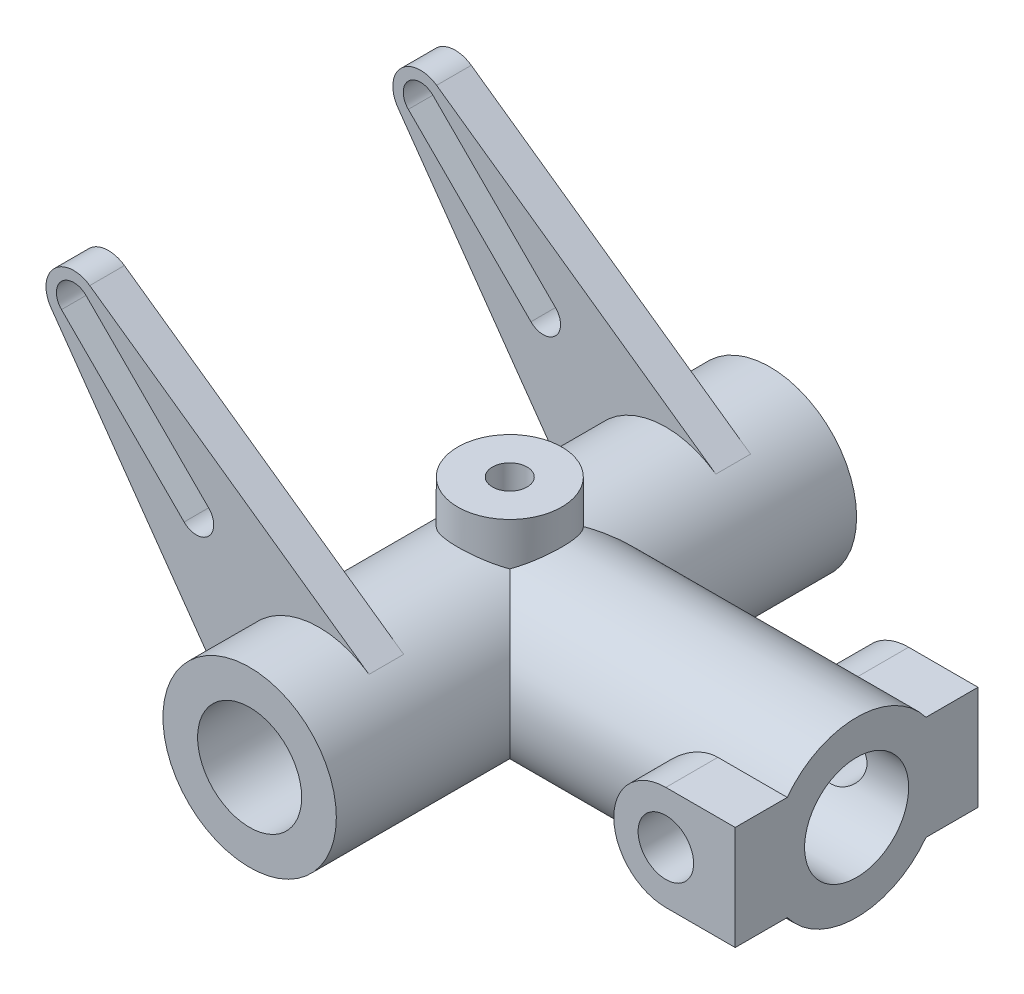
from build123d import *
from build123d.topology import SkipClean

# Parameters (mm, degrees)
CROQUIS1_R                   = 25
CROQUIS1_R_2                 = 15
SALIENTE_EXTRUIR1_DEPTH      = 150
SALIENTE_EXTRUIR2_DEPTH      = 10
SALIENTE_EXTRUIR3_START      = 10
SALIENTE_EXTRUIR3_DEPTH      = 10
SALIENTE_EXTRUIR4_REACH      = 248.237
SALIENTE_EXTRUIR4_END_RADIUS = 25
CROQUIS4_R                   = 25
CROQUIS4_R_2                 = 15
CROQUIS5_R                   = 8
SALIENTE_EXTRUIR5_DEPTH      = 35
CROQUIS6_R                   = 8
CORTAR_EXTRUIR1_DEPTH        = 169.212279189
CORTAR_EXTRUIR2_REACH        = 248.237
CROQUIS7_R                   = 15
SALIENTE_EXTRUIR6_REACH      = 192
SALIENTE_EXTRUIR6_END_RADIUS = 25
CROQUIS8_R                   = 15
CROQUIS8_R_2                 = 5
CORTAR_EXTRUIR3_REACH        = 192
CROQUIS9_R                   = 5


with BuildPart() as part:
    # Croquis1 → Saliente-Extruir1 (new body)
    with BuildSketch(Plane.XY):
        Circle(CROQUIS1_R)
        Circle(CROQUIS1_R_2, mode=Mode.SUBTRACT)
    extrude(amount=SALIENTE_EXTRUIR1_DEPTH)

    # Croquis2 → Saliente-Extruir2 (add)
    with BuildSketch(Plane.XY.offset(120)):
        with BuildLine():
            Line((-77.246856773, 66.097829909), (-20.425558294, -14.415150654))
            ThreePointArc((-20.425558294, -14.415150654), (-17.67766953, 17.67766953), (14.415150654, 20.425558294))
            Line((14.415150654, 20.425558294), (-66.097829909, 77.246856773))
            ThreePointArc((-66.097829909, 77.246856773), (-76.367532368, 76.367532368), (-77.246856773, 66.097829909))
        make_face()
        with BuildLine():
            Line((-67.175144213, 74.246212025), (-31.819805153, 38.890872965))
            ThreePointArc((-31.819805153, 38.890872965), (-31.819805153, 31.819805153), (-38.890872965, 31.819805153))
            Line((-38.890872965, 31.819805153), (-74.246212025, 67.175144213))
            ThreePointArc((-74.246212025, 67.175144213), (-74.246212025, 74.246212025), (-67.175144213, 74.246212025))
        make_face(mode=Mode.SUBTRACT)
    extrude(amount=SALIENTE_EXTRUIR2_DEPTH)

    # Croquis3 → Saliente-Extruir3 (add)
    with BuildSketch(Plane(origin=(0, 0, 30), x_dir=(-1, 0, 0), z_dir=(0, 0, -1)).offset(SALIENTE_EXTRUIR3_START)):
        with BuildLine():
            Line((77.246856773, 66.097829909), (20.425558294, -14.415150654))
            ThreePointArc((20.425558294, -14.415150654), (17.67766953, 17.67766953), (-14.415150654, 20.425558294))
            Line((-14.415150654, 20.425558294), (66.097829909, 77.246856773))
            ThreePointArc((66.097829909, 77.246856773), (76.367532368, 76.367532368), (77.246856773, 66.097829909))
        make_face()
        with BuildLine():
            Line((74.246212025, 67.175144213), (38.890872965, 31.819805153))
            ThreePointArc((38.890872965, 31.819805153), (31.819805153, 31.819805153), (31.819805153, 38.890872965))
            Line((31.819805153, 38.890872965), (67.175144213, 74.246212025))
            ThreePointArc((67.175144213, 74.246212025), (74.246212025, 74.246212025), (74.246212025, 67.175144213))
        make_face(mode=Mode.SUBTRACT)
    extrude(amount=-SALIENTE_EXTRUIR3_DEPTH)

    # Saliente-Extruir4: up to this cylinder (the profile starts outside it)
    saliente_extruir4_end = Plane(origin=(0, 0, 99.292893), z_dir=(0, 0, -1)) * Cylinder(SALIENTE_EXTRUIR4_END_RADIUS, 547.474, mode=Mode.PRIVATE)
    # Croquis4 → Saliente-Extruir4 (add, up to the surface)
    with BuildSketch(Plane(origin=(100, 0, 0), x_dir=(0, 0, -1), z_dir=(1, 0, 0)), mode=Mode.PRIVATE) as saliente_extruir4_sk1:
        with Locations((-75, 0)):
            Circle(CROQUIS4_R)
        with Locations((-75, 0)):
            Circle(CROQUIS4_R_2, mode=Mode.SUBTRACT)
    saliente_extruir4_tool1 = extrude(saliente_extruir4_sk1.sketch, amount=-SALIENTE_EXTRUIR4_REACH, mode=Mode.PRIVATE) - saliente_extruir4_end
    add(saliente_extruir4_tool1.solids().sort_by_distance((100, 0, 99.292893))[0])

    # Croquis5 → Saliente-Extruir5 (add, symmetric)
    with BuildSketch(Plane.XY.offset(75)):
        with BuildLine():
            Line((100, -15), (100, 0))
            Line((100, 0), (100, 15))
            Line((100, 15), (80, 15))
            ThreePointArc((80, 15), (65, 0), (80, -15))
            Line((80, -15), (100, -15))
        make_face()
        with Locations(Location((80, 0, 0), (0, 0, 180))):
            Circle(CROQUIS5_R, mode=Mode.SUBTRACT)
    extrude(amount=SALIENTE_EXTRUIR5_DEPTH, both=True)

    # Croquis6 → Cortar-Extruir1 (cut, through all)
    with BuildSketch(Plane.XY.offset(110)):
        with Locations((80, 0)):
            Circle(CROQUIS6_R)
    extrude(amount=-CORTAR_EXTRUIR1_DEPTH, mode=Mode.SUBTRACT)

    # Croquis7 → Cortar-Extruir2 (cut, up to next)
    with BuildSketch(Plane(origin=(100, 0, 0), x_dir=(0, 0, -1), z_dir=(1, 0, 0)), mode=Mode.PRIVATE) as cortar_extruir2_sk1:
        with Locations((-75, 0)):
            Circle(CROQUIS7_R)
    cortar_extruir2_tool1 = extrude(cortar_extruir2_sk1.sketch, amount=-CORTAR_EXTRUIR2_REACH, mode=Mode.PRIVATE) & part.part
    add(cortar_extruir2_tool1.solids().sort_by_distance((100, 0, 75))[0], mode=Mode.SUBTRACT)
    add(cortar_extruir2_tool1.solids().sort_by_distance((100, 0, 75))[1], mode=Mode.SUBTRACT)

    # Saliente-Extruir6: up to this cylinder (the profile starts outside it)
    with SkipClean():  # the faces are left unmerged after this step: merging them gives an invalid solid
        saliente_extruir6_end = Plane(origin=(0, 0, 60.424264), z_dir=(0, 0, -1)) * Cylinder(SALIENTE_EXTRUIR6_END_RADIUS, 435, mode=Mode.PRIVATE)
        # Croquis8 → Saliente-Extruir6 (add, up to the surface)
        with BuildSketch(Plane(origin=(0, 35, 0), x_dir=(1, 0, 0), z_dir=(0, 1, 0)), mode=Mode.PRIVATE) as saliente_extruir6_sk1:
            with Locations(Location((0, -75, 0), (0, 0, 270))):
                Circle(CROQUIS8_R)
            with Locations(Location((0, -75, 0), (0, 0, 270))):
                Circle(CROQUIS8_R_2, mode=Mode.SUBTRACT)
        saliente_extruir6_tool1 = extrude(saliente_extruir6_sk1.sketch, amount=-SALIENTE_EXTRUIR6_REACH, mode=Mode.PRIVATE) - saliente_extruir6_end
        add(saliente_extruir6_tool1.solids().sort_by_distance((0, 35, 60.424264))[0])

    # Croquis9 → Cortar-Extruir3 (cut, up to next)
    with BuildSketch(Plane(origin=(0, 35, 0), x_dir=(1, 0, 0), z_dir=(0, 1, 0)), mode=Mode.PRIVATE) as cortar_extruir3_sk1:
        with Locations(Location((0, -75, 0), (0, 0, 270))):
            Circle(CROQUIS9_R)
    cortar_extruir3_tool1 = extrude(cortar_extruir3_sk1.sketch, amount=-CORTAR_EXTRUIR3_REACH, mode=Mode.PRIVATE) & part.part
    add(cortar_extruir3_tool1.solids().sort_by_distance((0, 35, 75))[0], mode=Mode.SUBTRACT)


solid = part.part
